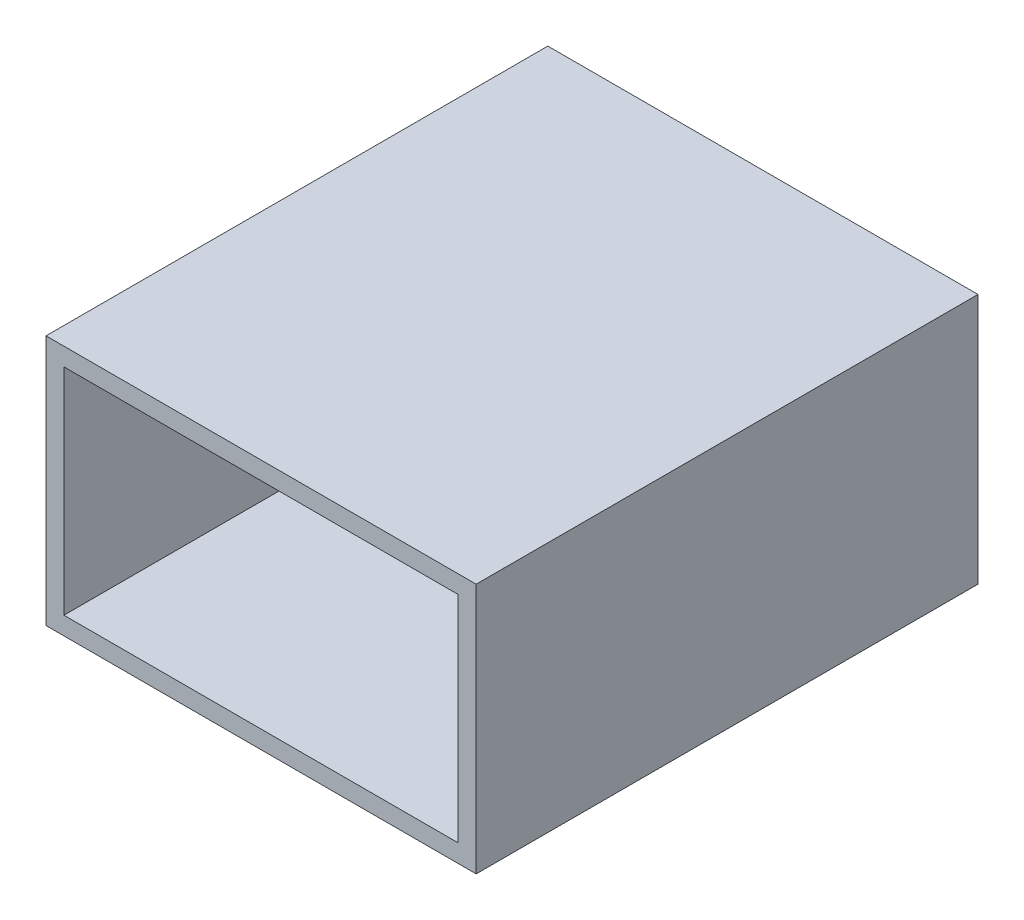
from build123d import *

# Parameters (mm, degrees)
SKETCH1_W           = 24
SKETCH1_H           = 14
BOSS_EXTRUDE4_DEPTH = 28
SKETCH3_W           = 22
SKETCH3_H           = 12
CUT_EXTRUDE1_DEPTH  = 27
SKETCH4_R           = 6
SKETCH4_R_2         = 2.487873036
CUT_EXTRUDE7_DEPTH  = 5


with BuildPart() as part:
    # Sketch1 → Boss-Extrude4 (new body)
    with BuildSketch(Plane.XY):
        with Locations((2.418604651, -2.093023256)):
            Rectangle(SKETCH1_W, SKETCH1_H)
    extrude(amount=-BOSS_EXTRUDE4_DEPTH)

    # Sketch3 → Cut-Extrude1 (cut)
    with BuildSketch(Plane.XY):
        with Locations((2.418604651, -2.093023256)):
            Rectangle(SKETCH3_W, SKETCH3_H)
    extrude(amount=-CUT_EXTRUDE1_DEPTH, mode=Mode.SUBTRACT)

    # Sketch4 → Cut-Extrude7 (cut)
    with BuildSketch(Plane.ZY.offset(9.581395349)):
        with Locations((-21, -2.093023256)):
            Circle(SKETCH4_R)
        with Locations((-13.5, -2.093023256)):
            Circle(SKETCH4_R_2)
    extrude(amount=-CUT_EXTRUDE7_DEPTH, mode=Mode.SUBTRACT)


solid = part.part
